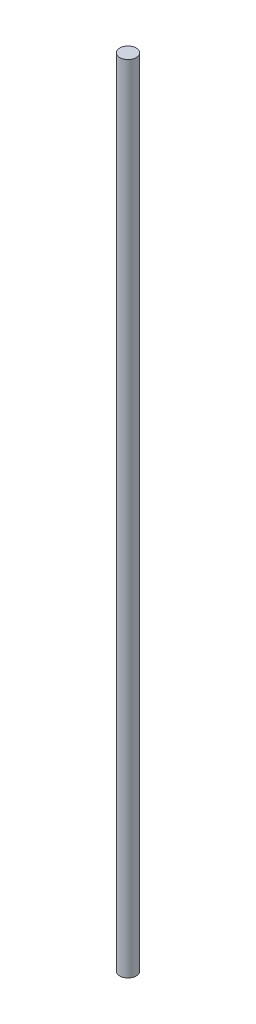
from build123d import *

# Parameters (mm, degrees)
SKETCH2_R           = 3.175
BOSS_EXTRUDE2_DEPTH = 304.8


with BuildPart() as part:
    # Sketch2 → Boss-Extrude2 (new body)
    with BuildSketch(Plane(origin=(0, 0, 0), x_dir=(1, 0, 0), z_dir=(0, 1, 0))):
        with Locations(Location((-66.878721707, 2.260679093, 0), (0, 0, 90))):
            Circle(SKETCH2_R)
    extrude(amount=BOSS_EXTRUDE2_DEPTH)


solid = part.part
